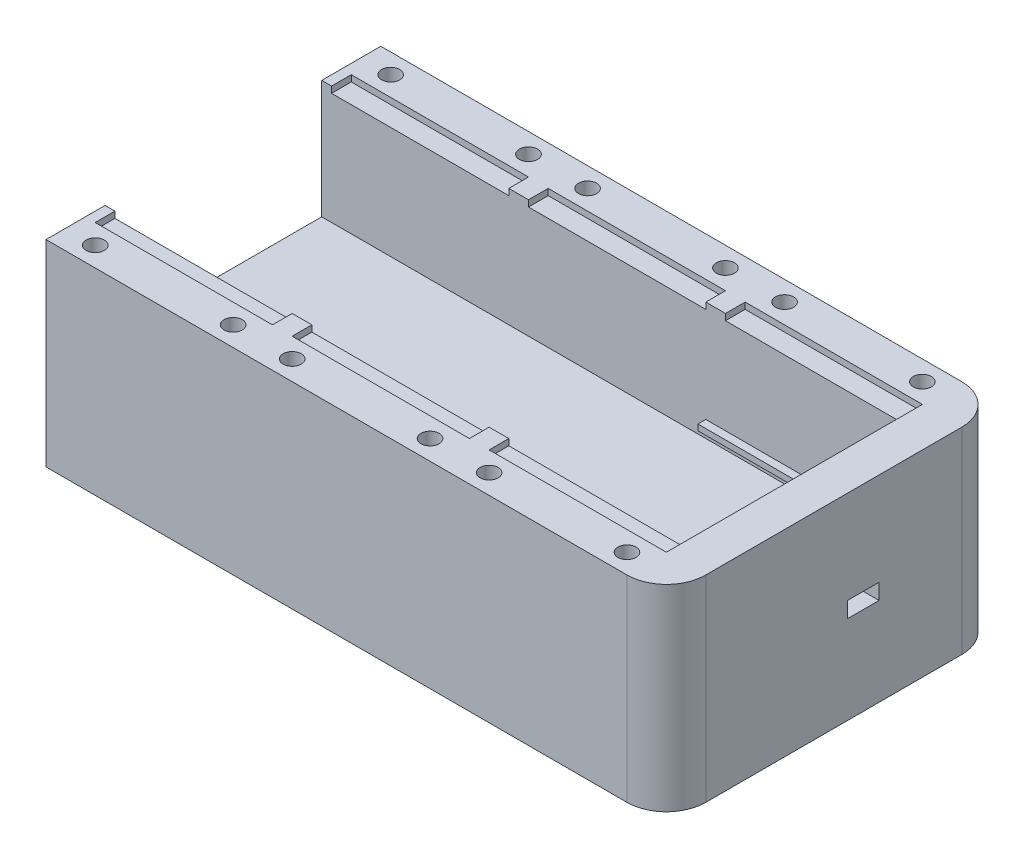
from build123d import *

# Parameters (mm, degrees)
SKIZZE2_W                       = 315
SKIZZE2_H                       = 50
AUFSATZ_LINEAR_AUSTRAGEN1_DEPTH = 85
SKIZZE4_W                       = 295
SKIZZE4_H                       = 55
SCHNITT_LINEAR_AUSTRAGEN1_DEPTH = 30
VERRUNDUNG1_R                   = 10
VERRUNDUNG2_R                   = 10
VERRUNDUNG3_R                   = 10
VERRUNDUNG4_R                   = 10
SKIZZE11_W                      = 45
SKIZZE11_H                      = 5
SKIZZE11_H_2                    = 5.008661904
SCHNITT_LINEAR_AUSTRAGEN4_DEPTH = 1.6
SKIZZE13_W                      = 295
SKIZZE13_H                      = 3
AUFSATZ_LINEAR_AUSTRAGEN2_DEPTH = 4.2
SKIZZE14_W                      = 8
SKIZZE14_H                      = 4
SCHNITT_LINEAR_AUSTRAGEN5_DEPTH = 19
SKIZZE15_W                      = 50
SKIZZE15_H                      = 1.5
AUFSATZ_LINEAR_AUSTRAGEN3_DEPTH = 2
SKIZZE16_W                      = 50
SKIZZE16_H                      = 1.5
AUFSATZ_LINEAR_AUSTRAGEN4_DEPTH = 2
SKIZZE17_R                      = 2.3
SCHNITT_LINEAR_AUSTRAGEN6_DEPTH = 4
SKIZZE18_W                      = 172.164344687
SKIZZE18_H                      = 85
SCHNITT_LINEAR_AUSTRAGEN7_DEPTH = 80


with BuildPart() as part:
    # Skizze2 → Aufsatz-Linear austragen1 (new body)
    with BuildSketch(Plane.XY):
        with Locations((157.5, 25)):
            Rectangle(SKIZZE2_W, SKIZZE2_H)
    extrude(amount=AUFSATZ_LINEAR_AUSTRAGEN1_DEPTH)

    # Skizze4 → Schnitt-Linear austragen1 (cut)
    with BuildSketch(Plane(origin=(0, 50, 0), x_dir=(1, 0, 0), z_dir=(0, 1, 0))):
        with Locations((157.5, -42.5)):
            Rectangle(SKIZZE4_W, SKIZZE4_H)
    extrude(amount=-SCHNITT_LINEAR_AUSTRAGEN1_DEPTH, mode=Mode.SUBTRACT)

    # Verrundung1
    verrundung1_edges = [part.edges().sort_by_distance(p)[0] for p in [
        (315, 25, 0),
    ]]
    fillet(verrundung1_edges, radius=VERRUNDUNG1_R)

    # Verrundung2
    verrundung2_edges = [part.edges().sort_by_distance(p)[0] for p in [
        (315, 25, 85),
    ]]
    fillet(verrundung2_edges, radius=VERRUNDUNG2_R)

    # Verrundung3
    verrundung3_edges = [part.edges().sort_by_distance(p)[0] for p in [
        (0, 25, 85),
    ]]
    fillet(verrundung3_edges, radius=VERRUNDUNG3_R)

    # Verrundung4
    verrundung4_edges = [part.edges().sort_by_distance(p)[0] for p in [
        (0, 25, 0),
    ]]
    fillet(verrundung4_edges, radius=VERRUNDUNG4_R)

    # Skizze11 → Schnitt-Linear austragen4 (cut)
    with BuildSketch(Plane(origin=(0, 50, 0), x_dir=(1, 0, 0), z_dir=(0, 1, 0))):
        with Locations((32.5, -12.5)):
            Rectangle(SKIZZE11_W, SKIZZE11_H)
        with Locations((32.5, -72.5)):
            Rectangle(SKIZZE11_W, SKIZZE11_H)
        with Locations((82.5, -72.5)):
            Rectangle(SKIZZE11_W, SKIZZE11_H)
        with Locations((132.5, -72.504330952)):
            Rectangle(SKIZZE11_W, SKIZZE11_H_2)
        with Locations((182.5, -72.504330952)):
            Rectangle(SKIZZE11_W, SKIZZE11_H_2)
        with Locations((232.5, -72.5)):
            Rectangle(SKIZZE11_W, SKIZZE11_H)
        with Locations((282.5, -72.5)):
            Rectangle(SKIZZE11_W, SKIZZE11_H)
        with Locations((282.5, -12.5)):
            Rectangle(SKIZZE11_W, SKIZZE11_H)
        with Locations((232.5, -12.5)):
            Rectangle(SKIZZE11_W, SKIZZE11_H)
        with Locations((182.5, -12.5)):
            Rectangle(SKIZZE11_W, SKIZZE11_H)
        with Locations((132.5, -12.5)):
            Rectangle(SKIZZE11_W, SKIZZE11_H)
        with Locations((82.5, -12.5)):
            Rectangle(SKIZZE11_W, SKIZZE11_H)
    extrude(amount=-SCHNITT_LINEAR_AUSTRAGEN4_DEPTH, mode=Mode.SUBTRACT)

    # Skizze13 → Aufsatz-Linear austragen2 (add)
    with BuildSketch(Plane(origin=(0, 20, 0), x_dir=(1, 0, 0), z_dir=(0, 1, 0))):
        with Locations((157.5, -68.5)):
            Rectangle(SKIZZE13_W, SKIZZE13_H)
    extrude(amount=AUFSATZ_LINEAR_AUSTRAGEN2_DEPTH)

    # Skizze14 → Schnitt-Linear austragen5 (cut)
    with BuildSketch(Plane.ZY.offset(-305)):
        with Locations((35, 24.4)):
            Rectangle(SKIZZE14_W, SKIZZE14_H)
    extrude(amount=-SCHNITT_LINEAR_AUSTRAGEN5_DEPTH, mode=Mode.SUBTRACT)

    # Skizze15 → Aufsatz-Linear austragen3 (add)
    with BuildSketch(Plane.XY.offset(15)):
        with Locations((280, 23.45)):
            Rectangle(SKIZZE15_W, SKIZZE15_H)
    extrude(amount=AUFSATZ_LINEAR_AUSTRAGEN3_DEPTH)

    # Skizze16 → Aufsatz-Linear austragen4 (add)
    with BuildSketch(Plane(origin=(0, 0, 67), x_dir=(-1, 0, 0), z_dir=(0, 0, -1))):
        with Locations((-280, 23.45)):
            Rectangle(SKIZZE16_W, SKIZZE16_H)
    extrude(amount=AUFSATZ_LINEAR_AUSTRAGEN4_DEPTH)

    # Skizze17 → Schnitt-Linear austragen6 (cut)
    with BuildSketch(Plane(origin=(0, 50, 0), x_dir=(1, 0, 0), z_dir=(0, 1, 0))):
        with Locations(Location((50, -80, 0), (0, 0, 270))):
            Circle(SKIZZE17_R)
        with Locations(Location((15, -80, 0), (0, 0, 270))):
            Circle(SKIZZE17_R)
        with Locations(Location((15, -5, 0), (0, 0, 270))):
            Circle(SKIZZE17_R)
        with Locations(Location((50, -5, 0), (0, 0, 270))):
            Circle(SKIZZE17_R)
        with Locations(Location((65, -5, 0), (0, 0, 270))):
            Circle(SKIZZE17_R)
        with Locations(Location((99.834927097, -5, 0), (0, 0, 270))):
            Circle(SKIZZE17_R)
        with Locations(Location((65, -80, 0), (0, 0, 270))):
            Circle(SKIZZE17_R)
        with Locations(Location((100, -80, 0), (0, 0, 270))):
            Circle(SKIZZE17_R)
        with Locations(Location((114.145512134, -79.164010762, 0), (0, 0, 270))):
            Circle(SKIZZE17_R)
        with Locations(Location((150, -80, 0), (0, 0, 270))):
            Circle(SKIZZE17_R)
        with Locations(Location((165, -80, 0), (0, 0, 270))):
            Circle(SKIZZE17_R)
        with Locations(Location((200, -80, 0), (0, 0, 270))):
            Circle(SKIZZE17_R)
        with Locations(Location((215, -80, 0), (0, 0, 270))):
            Circle(SKIZZE17_R)
        with Locations(Location((250, -80, 0), (0, 0, 270))):
            Circle(SKIZZE17_R)
        with Locations(Location((265, -80, 0), (0, 0, 270))):
            Circle(SKIZZE17_R)
        with Locations(Location((300, -80, 0), (0, 0, 270))):
            Circle(SKIZZE17_R)
        with Locations(Location((300, -5, 0), (0, 0, 270))):
            Circle(SKIZZE17_R)
        with Locations(Location((265, -5, 0), (0, 0, 270))):
            Circle(SKIZZE17_R)
        with Locations(Location((250, -5, 0), (0, 0, 270))):
            Circle(SKIZZE17_R)
        with Locations(Location((215, -5, 0), (0, 0, 270))):
            Circle(SKIZZE17_R)
        with Locations(Location((200, -5, 0), (0, 0, 270))):
            Circle(SKIZZE17_R)
        with Locations(Location((165, -5, 0), (0, 0, 270))):
            Circle(SKIZZE17_R)
        with Locations(Location((150, -5, 0), (0, 0, 270))):
            Circle(SKIZZE17_R)
        with Locations(Location((115, -5, 0), (0, 0, 270))):
            Circle(SKIZZE17_R)
    extrude(amount=-SCHNITT_LINEAR_AUSTRAGEN6_DEPTH, mode=Mode.SUBTRACT)

    # Skizze18 → Schnitt-Linear austragen7 (cut)
    with BuildSketch(Plane(origin=(0, 50, 0), x_dir=(1, 0, 0), z_dir=(0, 1, 0))):
        with Locations((71.417827656, -42.5)):
            Rectangle(SKIZZE18_W, SKIZZE18_H)
    extrude(amount=-SCHNITT_LINEAR_AUSTRAGEN7_DEPTH, mode=Mode.SUBTRACT)


solid = part.part
